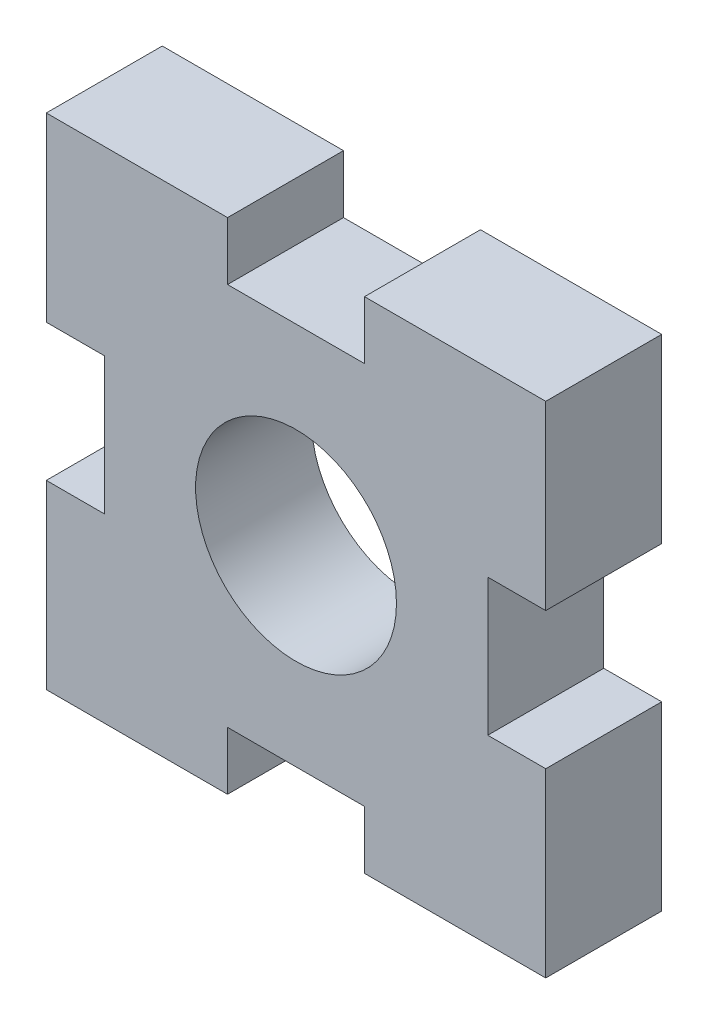
from build123d import *

# Parameters (mm, degrees)
SKETCH1_W           = 54.7
SKETCH1_H           = 54.7
BOSS_EXTRUDE1_DEPTH = 12.7
SKETCH2_W           = 15
SKETCH2_H           = 6.35
CUT_EXTRUDE1_DEPTH  = 41.710379512
SKETCH3_R           = 11
CUT_EXTRUDE2_DEPTH  = 41.710379512
CIRPATTERN1_COUNT   = 4


with BuildPart() as part:
    # Sketch1 → Boss-Extrude1 (new body)
    with BuildSketch(Plane.XY):
        Rectangle(SKETCH1_W, SKETCH1_H)
    extrude(amount=BOSS_EXTRUDE1_DEPTH)

    # Sketch2 → Cut-Extrude1 (cut, through all)
    with BuildSketch(Plane.XY.offset(12.7)):
        with Locations((0, 24.175)):
            Rectangle(SKETCH2_W, SKETCH2_H)
    cut_extrude1 = extrude(amount=-CUT_EXTRUDE1_DEPTH, mode=Mode.SUBTRACT)

    # Sketch3 → Cut-Extrude2 (cut, through all)
    with BuildSketch(Plane.XY.offset(12.7)):
        Circle(SKETCH3_R)
    extrude(amount=-CUT_EXTRUDE2_DEPTH, mode=Mode.SUBTRACT)

    # CirPattern1: Cut-Extrude1 ×4 about axis
    cirpattern1_axis = Axis((0, 0, 0), (0, 0, 1))
    for i in range(1, CIRPATTERN1_COUNT):
        add(cut_extrude1.rotate(cirpattern1_axis, i * 360 / CIRPATTERN1_COUNT), mode=Mode.SUBTRACT)


solid = part.part
